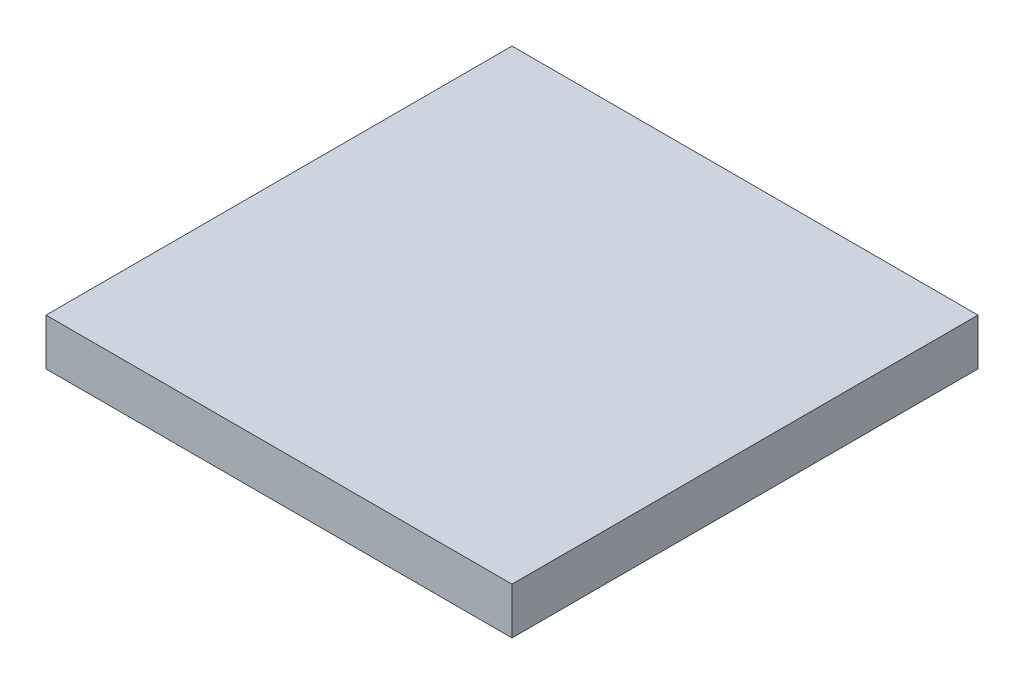
from build123d import *

# Parameters (mm, degrees)
SKETCH1_W           = 20
SKETCH1_H           = 20
BOSS_EXTRUDE1_DEPTH = 2


with BuildPart() as part:
    # Sketch1 → Boss-Extrude1 (new body)
    with BuildSketch(Plane(origin=(0, 0, 0), x_dir=(1, 0, 0), z_dir=(0, 1, 0))):
        Rectangle(SKETCH1_W, SKETCH1_H)
    extrude(amount=BOSS_EXTRUDE1_DEPTH)


solid = part.part
